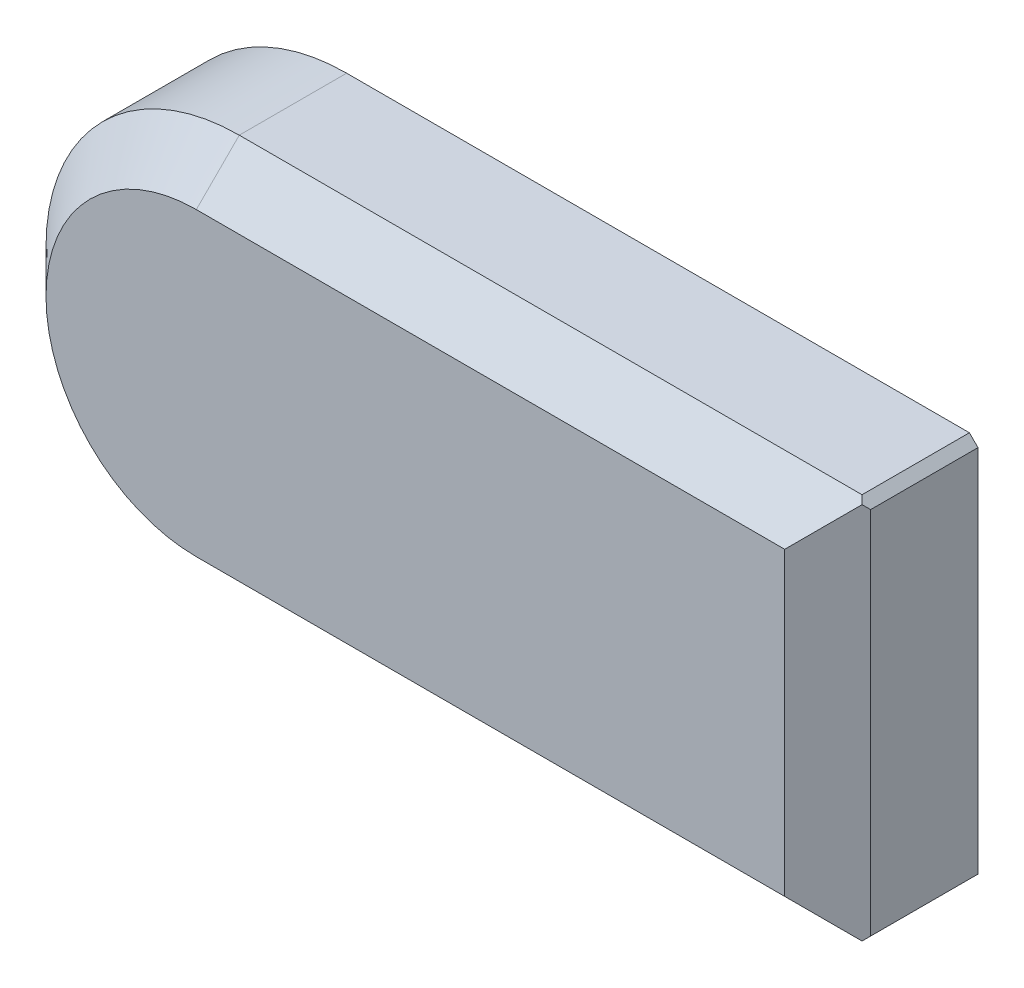
from build123d import *

# Parameters (mm, degrees)
EXTRUDE_1_DEPTH     = 17.5
CHAMFER_1_SIZE      = 5
SHELL_1_T           = -2.5
CUT_EXTRUDE_1_DEPTH = 1.2
SKETCH_3_R          = 5
EXTRUDE_2_DEPTH     = 14
CUT_EXTRUDE_2_DEPTH = 2.4
SKETCH_5_R          = 1.6
CUT_EXTRUDE_3_DEPTH = 6
CHAMFER_2_SIZE      = 1


with BuildPart() as part:
    # 草图1 → 凸台-拉伸1 (new body)
    with BuildSketch(Plane.XY):
        with BuildLine():
            ThreePointArc((-14.25, 0), (-20.840097423, 15.909902577), (-36.75, 22.5))
            Line((-36.75, 22.5), (-36.75, -22.5))
            ThreePointArc((-36.75, -22.5), (-20.840097423, -15.909902577), (-14.25, 0))
        make_face()
        with BuildLine():
            Line((-36.75, -22.5), (-36.75, 22.5))
            ThreePointArc((-36.75, 22.5), (-59.25, 0), (-36.75, -22.5))
        make_face()
        with BuildLine():
            Line((36.75, 22.5), (-36.75, 22.5))
            ThreePointArc((-36.75, 22.5), (-20.840097423, 15.909902577), (-14.25, 0))
            ThreePointArc((-14.25, 0), (-20.840097423, -15.909902577), (-36.75, -22.5))
            Line((-36.75, -22.5), (36.75, -22.5))
            Line((36.75, -22.5), (36.75, 22.5))
        make_face()
    extrude(amount=EXTRUDE_1_DEPTH)

    # 倒角1
    chamfer_1_edges = [part.edges().sort_by_distance(p)[0] for p in [
        (0, -22.5, 17.5),
        (36.75, 0, 17.5),
        (0, 22.5, 17.5),
        (-59.25, 0, 17.5),
    ]]
    chamfer(chamfer_1_edges, length=CHAMFER_1_SIZE)

    # 抽壳1
    shell_1_openings = [part.faces().sort_by_distance(p)[0] for p in [
        (-8.974037689, 0, 0),
    ]]
    offset(amount=SHELL_1_T, openings=shell_1_openings, kind=Kind.INTERSECTION)

    # 草图2 → 切除-拉伸1 (cut)
    with BuildSketch(Plane(origin=(0, 0, 0), x_dir=(-1, 0, 0), z_dir=(0, 0, -1))):
        with BuildLine():
            Line((36.75, 21.2), (-35.45, 21.2))
            Line((-35.45, 21.2), (-35.45, -21.2))
            Line((-35.45, -21.2), (36.75, -21.2))
            ThreePointArc((36.75, -21.2), (57.95, 0), (36.75, 21.2))
        make_face()
        with BuildLine():
            Line((36.75, -20), (-34.25, -20))
            Line((-34.25, -20), (-34.25, 20))
            Line((-34.25, 20), (36.75, 20))
            ThreePointArc((36.75, 20), (56.75, 0), (36.75, -20))
        make_face(mode=Mode.SUBTRACT)
    extrude(amount=-CUT_EXTRUDE_1_DEPTH, mode=Mode.SUBTRACT)

    # 草图3 → 凸台-拉伸2 (add)
    with BuildSketch(Plane(origin=(0, 0, 15), x_dir=(-1, 0, 0), z_dir=(0, 0, -1))):
        with Locations(Location((11.25, 0, 0), (0, 0, 180))):
            Circle(SKETCH_3_R)
    extrude(amount=EXTRUDE_2_DEPTH)

    # 草图4 → 切除-拉伸2 (cut)
    with BuildSketch(Plane(origin=(0, 0, 1), x_dir=(-1, 0, 0), z_dir=(0, 0, -1))):
        Polygon((9.66228676, -2.75), (12.83771324, -2.75), (14.425426481, 0), (12.83771324, 2.75), (9.66228676, 2.75), (8.074573519, 0), align=None)
    extrude(amount=-CUT_EXTRUDE_2_DEPTH, mode=Mode.SUBTRACT)

    # 草图5 → 切除-拉伸3 (cut)
    with BuildSketch(Plane(origin=(0, 0, 3.4), x_dir=(-1, 0, 0), z_dir=(0, 0, -1))):
        with Locations((11.25, 0)):
            Circle(SKETCH_5_R)
    extrude(amount=-CUT_EXTRUDE_3_DEPTH, mode=Mode.SUBTRACT)

    # 倒角2
    chamfer_2_edges = [part.edges().sort_by_distance(p)[0] for p in [
        (36.75, -22.5, 6.25),
        (36.75, 22.5, 6.25),
    ]]
    chamfer(chamfer_2_edges, length=CHAMFER_2_SIZE)


solid = part.part
